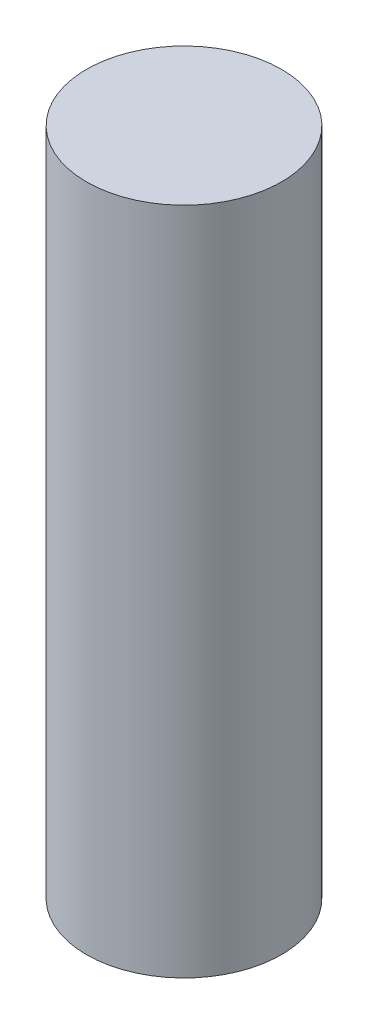
from build123d import *

# Parameters (mm, degrees)
ESBO_O1_R                = 9.5
RESSALTO_EXTRUS_O1_DEPTH = 65.2


with BuildPart() as part:
    # Esboço1 → Ressalto-extrusão1 (new body)
    with BuildSketch(Plane(origin=(0, 0, 0), x_dir=(1, 0, 0), z_dir=(0, 1, 0))):
        with Locations(Location((0, 0, 0), (0, 0, 270))):
            Circle(ESBO_O1_R)
    extrude(amount=RESSALTO_EXTRUS_O1_DEPTH)


solid = part.part
